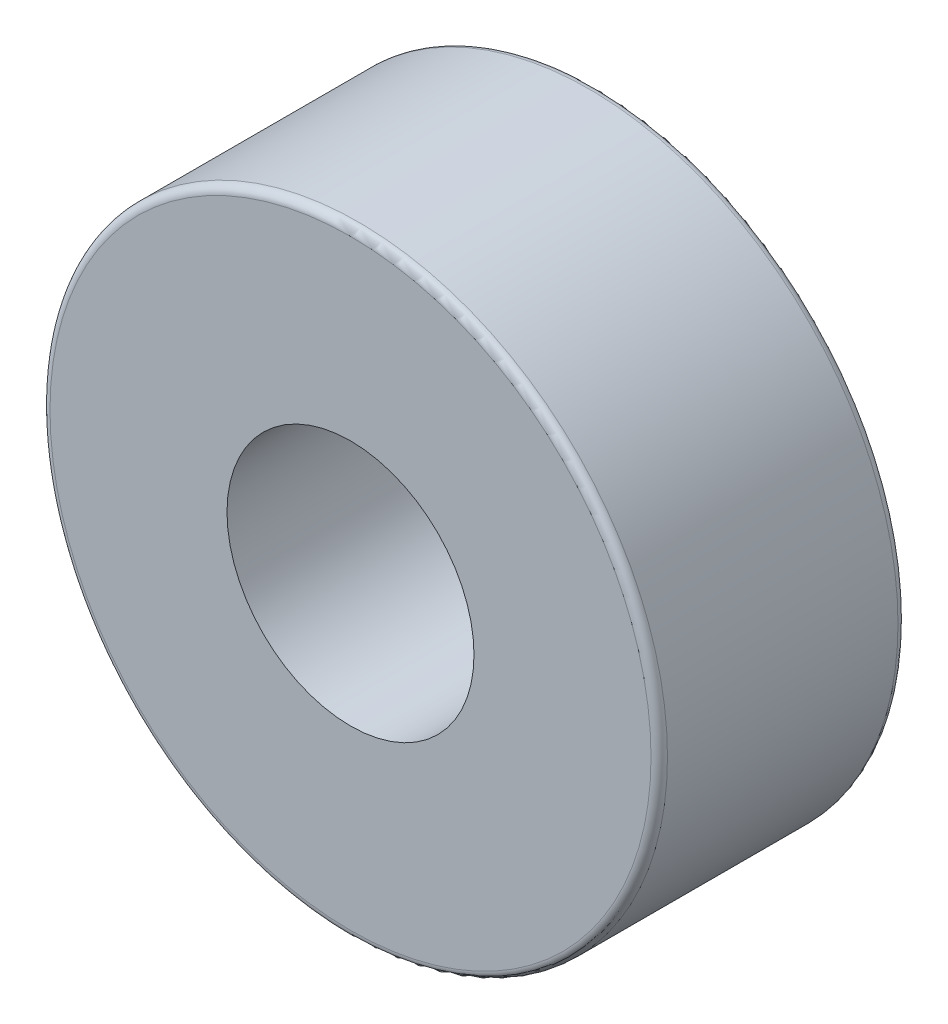
from build123d import *

# Parameters (mm, degrees)
SKETCH1_R           = 7.5
BOSS_EXTRUDE1_DEPTH = 6
SKETCH2_R           = 3
CUT_EXTRUDE1_DEPTH  = 6
FILLET1_R           = 0.2


with BuildPart() as part:
    # Sketch1 → Boss-Extrude1 (new body)
    with BuildSketch(Plane.XY):
        Circle(SKETCH1_R)
    extrude(amount=BOSS_EXTRUDE1_DEPTH)

    # Sketch2 → Cut-Extrude1 (cut)
    with BuildSketch(Plane.XY):
        with Locations(Location((0, 0, 0), (0, 0, 180))):
            Circle(SKETCH2_R)
    extrude(amount=CUT_EXTRUDE1_DEPTH, mode=Mode.SUBTRACT)

    # Fillet1
    fillet1_edges = [part.edges().sort_by_distance(p)[0] for p in [
        (-7.5, 0, 0),
        (-7.5, 0, 6),
    ]]
    fillet(fillet1_edges, radius=FILLET1_R)


solid = part.part
